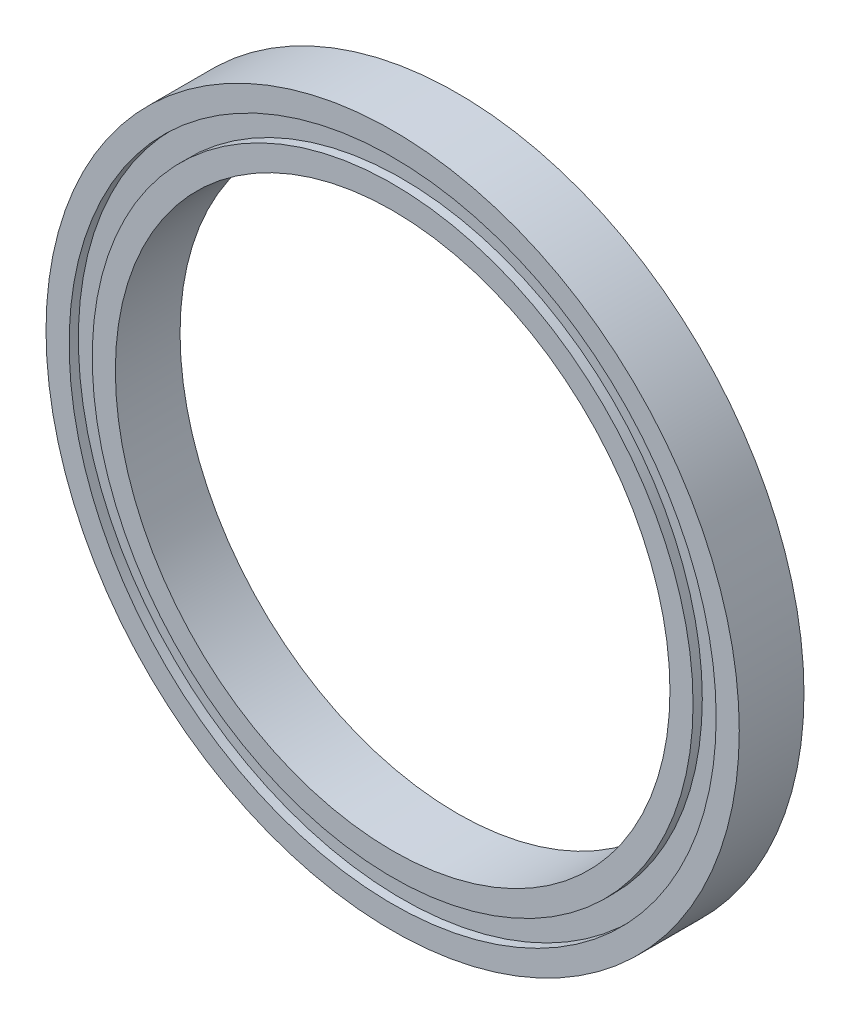
from build123d import *

# Parameters (mm, degrees)
SKETCH_1_R          = 37.5
SKETCH_1_R_2        = 30
EXTRUDE_1_DEPTH     = 7
SKETCH_2_R          = 35
SKETCH_2_R_2        = 32.5
CUT_EXTRUDE_1_DEPTH = 1
CUT_EXTRUDE_START   = -1
SKETCH_3_R          = 35
SKETCH_3_R_2        = 32.5
CUT_EXTRUDE_2_DEPTH = 1


with BuildPart() as part:
    # 草图1 → 凸台-拉伸1 (new body)
    with BuildSketch(Plane.XY):
        Circle(SKETCH_1_R)
        Circle(SKETCH_1_R_2, mode=Mode.SUBTRACT)
    extrude(amount=EXTRUDE_1_DEPTH)

    # 草图2 → 切除-拉伸1 (cut)
    with BuildSketch(Plane.XY.offset(7)):
        Circle(SKETCH_2_R)
        Circle(SKETCH_2_R_2, mode=Mode.SUBTRACT)
    extrude(amount=-CUT_EXTRUDE_1_DEPTH, mode=Mode.SUBTRACT)

    # 草图3 → 切除-拉伸2 (cut)
    with BuildSketch(Plane(origin=(0, 0, 0), x_dir=(-1, 0, 0), z_dir=(0, 0, -1)).offset(CUT_EXTRUDE_START)):
        with Locations(Location((0, 0, 0), (0, 0, 180))):
            Circle(SKETCH_3_R)
        with Locations(Location((0, 0, 0), (0, 0, 180))):
            Circle(SKETCH_3_R_2, mode=Mode.SUBTRACT)
    extrude(amount=CUT_EXTRUDE_2_DEPTH, mode=Mode.SUBTRACT)


solid = part.part
